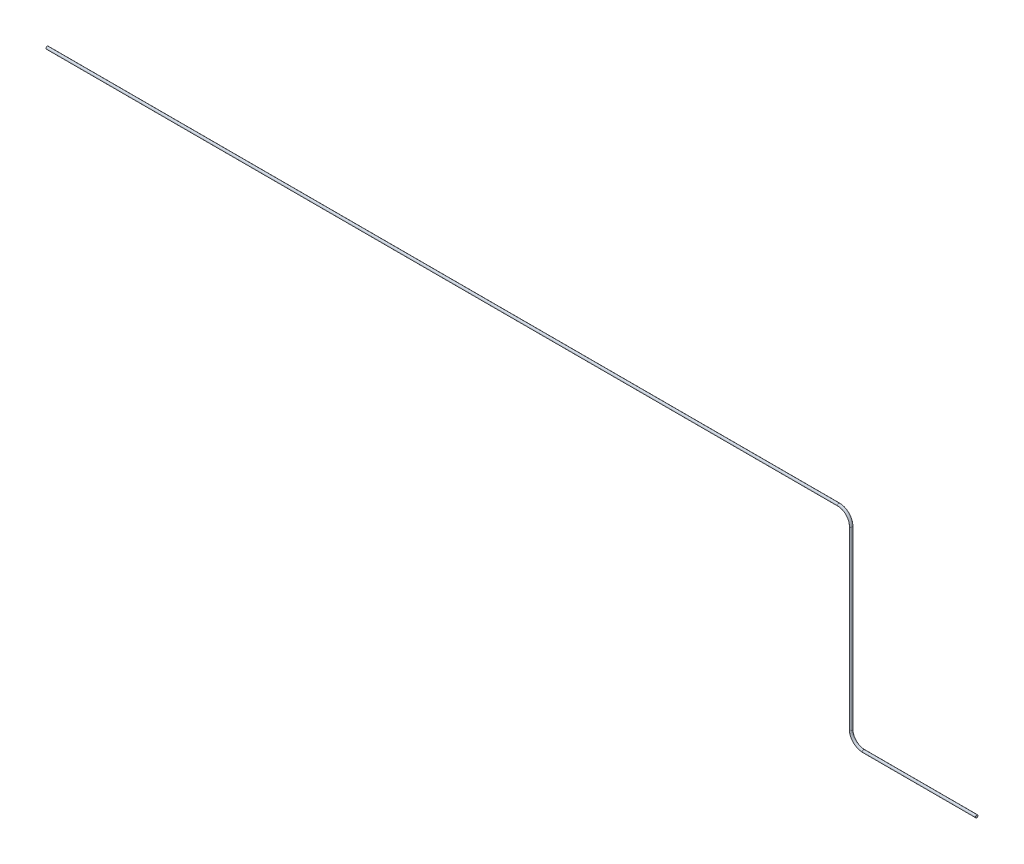
from build123d import *

# Parameters (mm, degrees)
SKETCH_2_R = 0.5


with BuildPart() as part:
    # ｽｲｰﾌﾟ1: sweep along a path in ｽｹｯﾁ1
    with BuildLine(Plane.XY) as sweep_1_path:
        Line((-320, 40), (-5, 40))
        ThreePointArc((-5, 40), (-1.464466094, 38.535533906), (0, 35))
        Line((0, 35), (0, -35))
        ThreePointArc((0, -35), (1.464466094, -38.535533906), (5, -40))
        Line((5, -40), (50, -40))
    # ｽｹｯﾁ2 → ｽｲｰﾌﾟ1 (sweep)
    with BuildSketch(Plane(origin=(50, 0, 0), x_dir=(0, 0, -1), z_dir=(1, 0, 0))):
        with Locations((0, -40)):
            Circle(SKETCH_2_R)
    sweep(path=sweep_1_path.line)


solid = part.part
